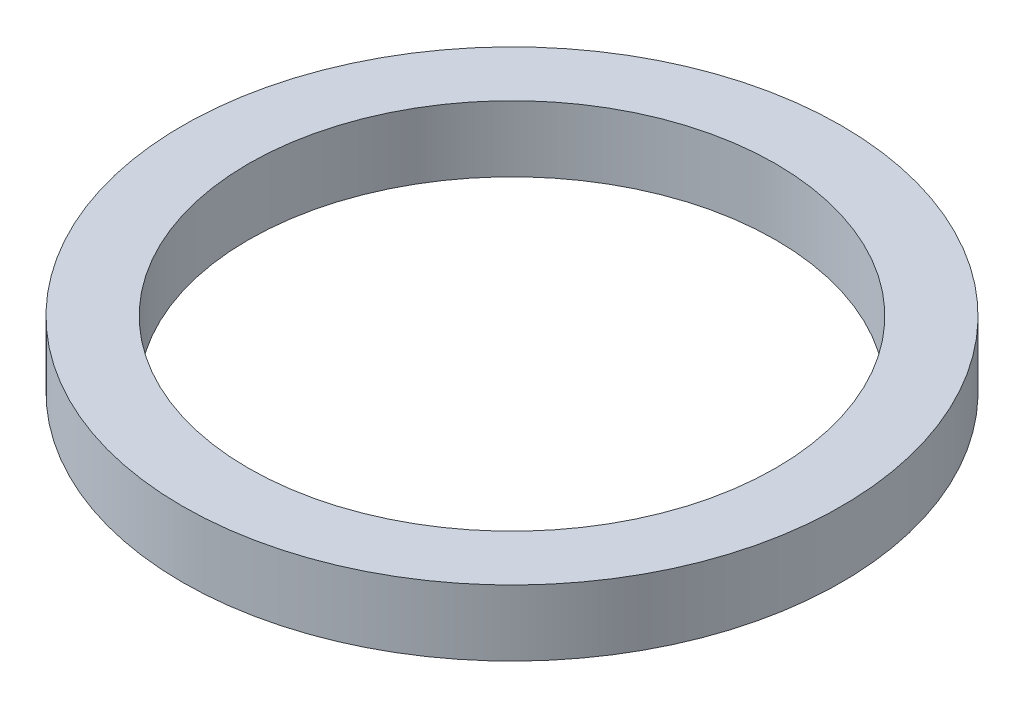
from build123d import *

# Parameters (mm, degrees)
ESQUISSE1_R        = 5
ESQUISSE1_R_2      = 4
BOSS_EXTRU_1_DEPTH = 1


with BuildPart() as part:
    # Esquisse1 → Boss.-Extru.1 (new body)
    with BuildSketch(Plane(origin=(0, 0, 0), x_dir=(1, 0, 0), z_dir=(0, 1, 0))):
        with Locations(Location((0, 0, 0), (0, 0, 270))):
            Circle(ESQUISSE1_R)
        with Locations(Location((0, 0, 0), (0, 0, 270))):
            Circle(ESQUISSE1_R_2, mode=Mode.SUBTRACT)
    extrude(amount=BOSS_EXTRU_1_DEPTH)


solid = part.part
